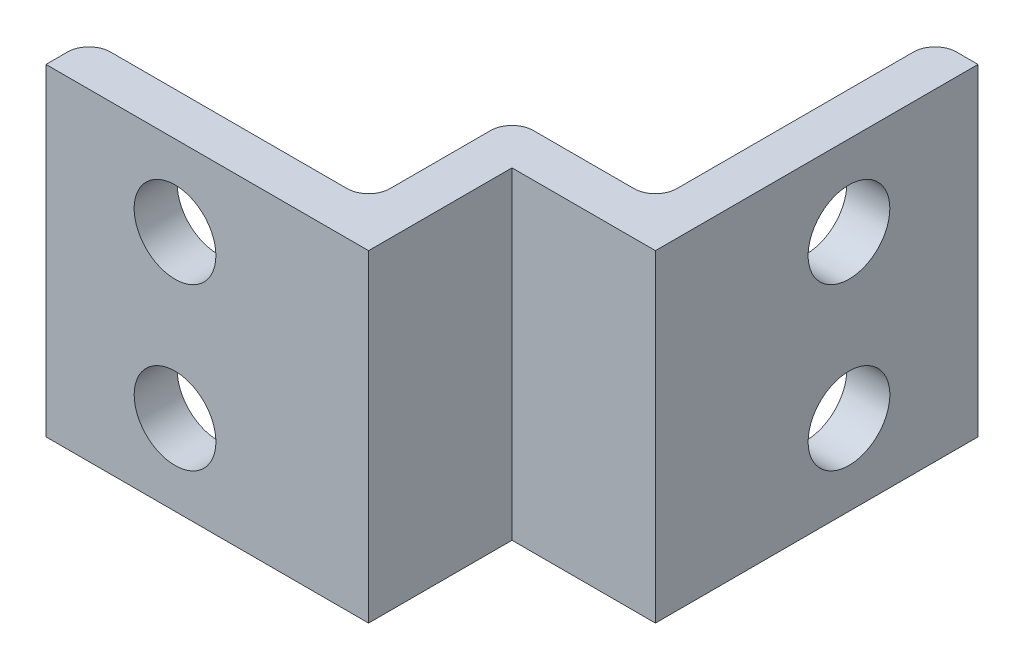
from build123d import *

# Parameters (mm, degrees)
SKETCH2_W           = 38.1
SKETCH2_H           = 38.1
BOSS_EXTRUDE1_DEPTH = 5.08
SKETCH3_W           = 22.0218
SKETCH3_H           = 38.1
BOSS_EXTRUDE2_DEPTH = 5.08
SKETCH4_W           = 22.0218
SKETCH4_H           = 38.1
BOSS_EXTRUDE3_DEPTH = 5.08
SKETCH5_W           = 38.1
SKETCH5_H           = 38.1
BOSS_EXTRUDE4_DEPTH = 5.08
SKETCH6_R           = 4.826
CUT_EXTRUDE1_DEPTH  = 87.664926553
SKETCH7_R           = 4.826
CUT_EXTRUDE2_DEPTH  = 87.664926553
FILLET1_R           = 2.54
FILLET2_R           = 2.54
FILLET3_R           = 2.54
FILLET4_R           = 2.54
FILLET5_R           = 2.54


with BuildPart() as part:
    # Sketch2 → Boss-Extrude1 (new body)
    with BuildSketch(Plane.XY):
        with Locations((19.05, 19.05)):
            Rectangle(SKETCH2_W, SKETCH2_H)
    extrude(amount=-BOSS_EXTRUDE1_DEPTH)

    # Sketch3 → Boss-Extrude2 (add)
    with BuildSketch(Plane(origin=(38.1, 0, 0), x_dir=(0, 0, -1), z_dir=(1, 0, 0))):
        with Locations((11.0109, 19.05)):
            Rectangle(SKETCH3_W, SKETCH3_H)
    extrude(amount=-BOSS_EXTRUDE2_DEPTH)

    # Sketch4 → Boss-Extrude3 (add)
    with BuildSketch(Plane(origin=(0, 0, -22.0218), x_dir=(-1, 0, 0), z_dir=(0, 0, -1))):
        with Locations((-44.0309, 19.05)):
            Rectangle(SKETCH4_W, SKETCH4_H)
    extrude(amount=-BOSS_EXTRUDE3_DEPTH)

    # Sketch5 → Boss-Extrude4 (add)
    with BuildSketch(Plane(origin=(55.0418, 0, 0), x_dir=(0, 0, -1), z_dir=(1, 0, 0))):
        with Locations((35.9918, 19.05)):
            Rectangle(SKETCH5_W, SKETCH5_H)
    extrude(amount=-BOSS_EXTRUDE4_DEPTH)

    # Sketch6 → Cut-Extrude1 (cut, through all)
    with BuildSketch(Plane(origin=(55.0418, 0, 0), x_dir=(0, 0, -1), z_dir=(1, 0, 0))):
        with Locations((39.8018, 28.575)):
            Circle(SKETCH6_R)
        with Locations(Location((39.8018, 9.525, 0), (0, 0, 180))):
            Circle(SKETCH6_R)
    extrude(amount=-CUT_EXTRUDE1_DEPTH, mode=Mode.SUBTRACT)

    # Sketch7 → Cut-Extrude2 (cut, through all)
    with BuildSketch(Plane.XY):
        with Locations((15.24, 28.575)):
            Circle(SKETCH7_R)
        with Locations(Location((15.24, 9.525, 0), (0, 0, 180))):
            Circle(SKETCH7_R)
    extrude(amount=-CUT_EXTRUDE2_DEPTH, mode=Mode.SUBTRACT)

    # Fillet1
    fillet1_edges = [part.edges().sort_by_distance(p)[0] for p in [
        (49.9618, 19.05, -55.0418),
    ]]
    fillet(fillet1_edges, radius=FILLET1_R)

    # Fillet2
    fillet2_edges = [part.edges().sort_by_distance(p)[0] for p in [
        (49.9618, 19.05, -22.0218),
    ]]
    fillet(fillet2_edges, radius=FILLET2_R)

    # Fillet3
    fillet3_edges = [part.edges().sort_by_distance(p)[0] for p in [
        (33.02, 19.05, -22.0218),
    ]]
    fillet(fillet3_edges, radius=FILLET3_R)

    # Fillet4
    fillet4_edges = [part.edges().sort_by_distance(p)[0] for p in [
        (33.02, 19.05, -5.08),
    ]]
    fillet(fillet4_edges, radius=FILLET4_R)

    # Fillet5
    fillet5_edges = [part.edges().sort_by_distance(p)[0] for p in [
        (0, 19.05, -5.08),
    ]]
    fillet(fillet5_edges, radius=FILLET5_R)


solid = part.part
